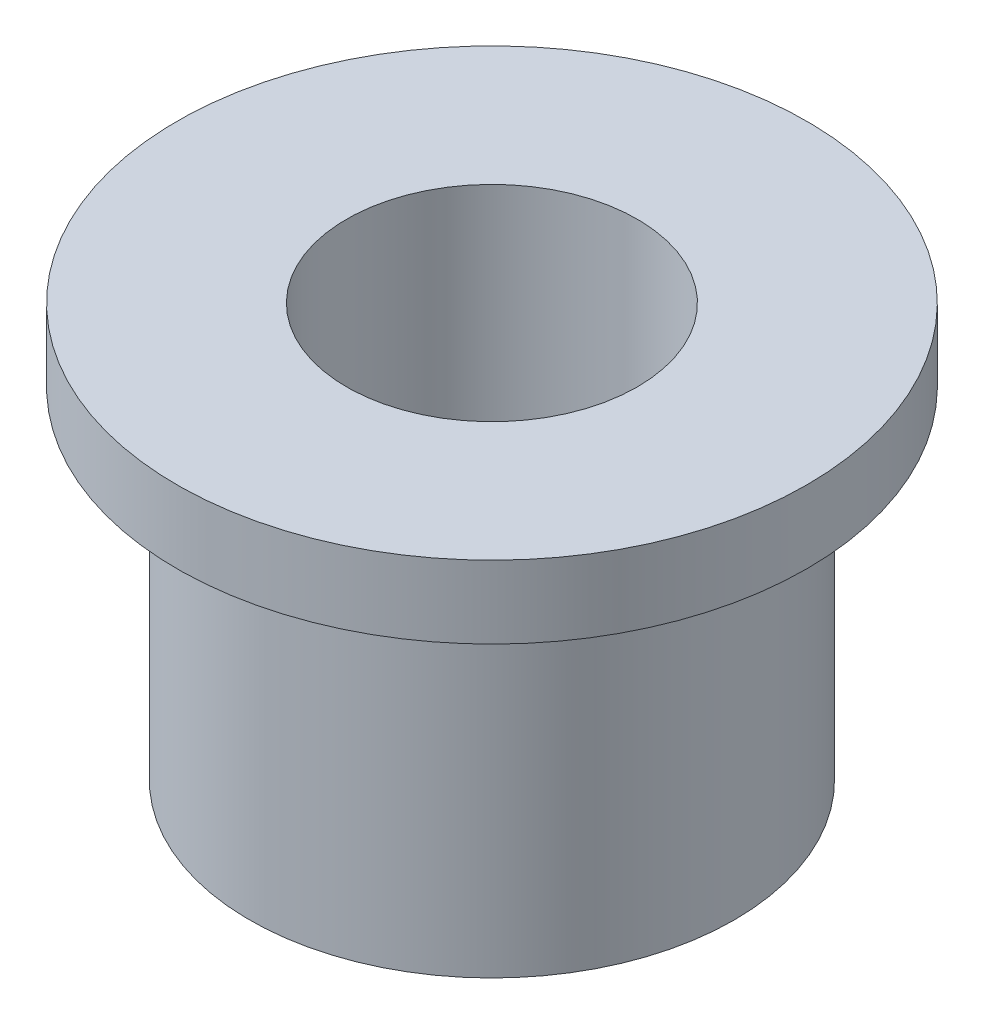
from build123d import *


with BuildPart() as part:
    # 草图1 → 旋转1 (revolve)
    with BuildSketch(Plane.XY):
        Polygon((3, 8.528688525), (6.5, 8.528688525), (6.5, 7.028688525), (5, 7.028688525), (5, 0), (3, 0), align=None)
    revolve(axis=Axis((0, -171.557870599, 0), (0, 1, 0)))


solid = part.part
